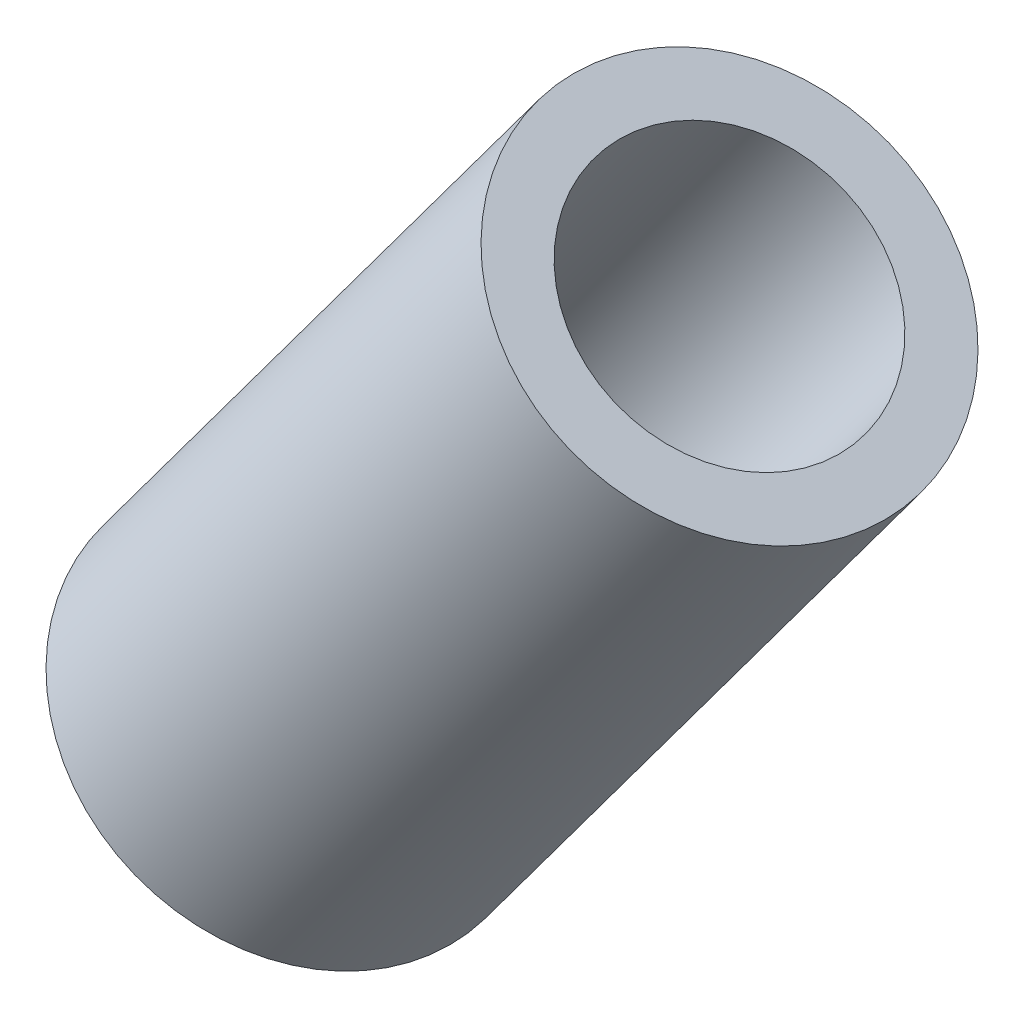
from build123d import *

# Parameters (mm, degrees)
SWEEP1_PROFILE_R     = 13.49375
CUT_SWEEP1_PROFILE_R = 9.525


with BuildPart() as part:
    # Sweep1: sweep along a curve in space
    with BuildLine() as sweep1_path:
        Line((0, 0, 0), (30.290133782, 40.78170908, 0))
    # Sweep1 profile (on start of the path) → Sweep1 (sweep)
    with BuildSketch(Plane(origin=(0, 0, 0), x_dir=(0.8027895488189021, -0.5962624760180233, 0), z_dir=(0.5962624760180233, 0.8027895488189021, 0))):
        Circle(SWEEP1_PROFILE_R)
    sweep(path=sweep1_path.line)

    # Cut-Sweep1: sweep along a curve in space
    with BuildLine() as cut_sweep1_path:
        Line((0, 0, 0), (30.290133782, 40.78170908, 0))
    # Cut-Sweep1 profile (on start of the path) → Cut-Sweep1 (sweep, cut)
    with BuildSketch(Plane(origin=(0, 0, 0), x_dir=(0.8027895488189021, -0.5962624760180233, 0), z_dir=(0.5962624760180233, 0.8027895488189021, 0))):
        Circle(CUT_SWEEP1_PROFILE_R)
    sweep(path=cut_sweep1_path.line, mode=Mode.SUBTRACT)


solid = part.part
